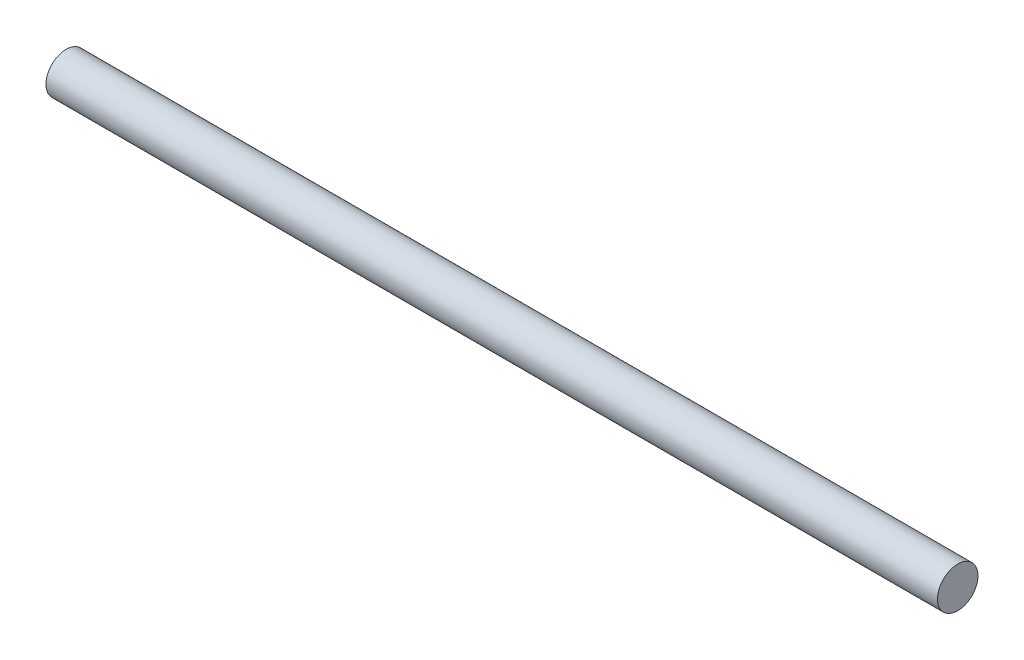
from build123d import *

# Parameters (mm, degrees)
SKETCH1_R           = 3.175
BOSS_EXTRUDE1_DEPTH = 69.85


with BuildPart() as part:
    # Sketch1 → Boss-Extrude1 (new, symmetric)
    with BuildSketch(Plane(origin=(0, 0, 0), x_dir=(0, 0, -1), z_dir=(1, 0, 0))):
        Circle(SKETCH1_R)
    extrude(amount=BOSS_EXTRUDE1_DEPTH, both=True)


solid = part.part
